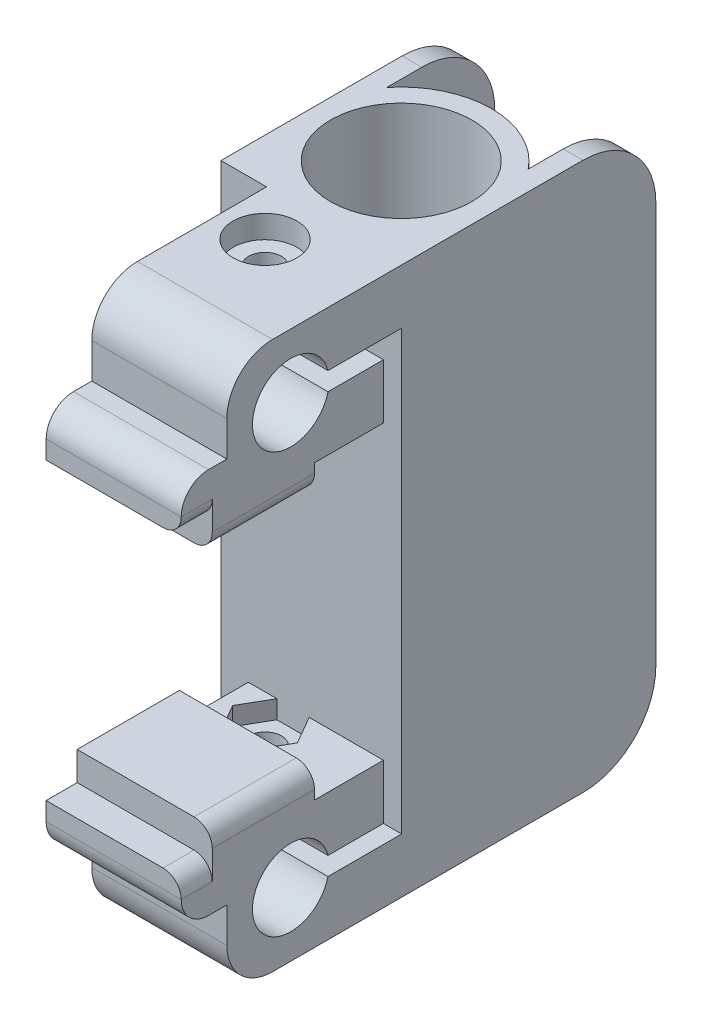
from build123d import *

# Parameters (mm, degrees)
SKETCH_1_W                = 15.5
SKETCH_1_H                = 11.302783866
EXTRUDE_1_DEPTH           = 60
SKETCH_2_R                = 4.2
CUT_EXTRUDE_1_DEPTH       = 90
CUT_EXTRUDE_2_DEPTH       = 40
SKETCH_4_W                = 15.5
SKETCH_4_H                = 19.5
SKETCH_4_H_2              = 7
CUT_EXTRUDE_3_DEPTH       = 6
FILLET_1_R                = 5
FILLET_2_R                = 8
SKETCH_13_R               = 1.8
CUT_EXTRUDE_9_DEPTH       = 75
CUT_EXTRUDE_10_DEPTH      = 34
CUT_EXTRUDE_10_DEPTH_BACK = 2
SKETCH_15_R               = 3.5
CUT_EXTRUDE_11_DEPTH      = 2.5
CUT_EXTRUDE_START         = -2.5
SKETCH_16_R               = 3.5
CUT_EXTRUDE_12_DEPTH      = 2.5
EXTRUDE_2_DEPTH           = 19.8
FILLET_3_R                = 3
SKETCH_18_R               = 2.25
CUT_EXTRUDE_13_DEPTH      = 9
FILLET_4_R                = 2
SKETCH_19_W               = 40.971402115
SKETCH_19_H               = 78.896815639
CUT_EXTRUDE_14_DEPTH      = 5


with BuildPart() as part:
    # Эскиз1 → Бобышка-Вытянуть1 (new body)
    with BuildSketch(Plane(origin=(0, 0, 0), x_dir=(1, 0, 0), z_dir=(0, 1, 0))):
        with BuildLine():
            Line((7.75, 0), (7.75, 6.160154219))
            ThreePointArc((7.75, 6.160154219), (0, 9.9), (-7.75, 6.160154219))
            Line((-7.75, 6.160154219), (-7.75, 1e-08))
            ThreePointArc((-7.75, 1e-08), (5e-09, 7.75), (7.75, 0))
        make_face()
        with BuildLine():
            ThreePointArc((0, -9.9), (4.302584876, -8.916151826), (7.75, -6.160154219))
            Line((7.75, -6.160154219), (7.75, 0))
            ThreePointArc((7.75, 0), (-5e-09, -7.75), (-7.75, 1e-08))
            Line((-7.75, 1e-08), (-7.75, -6.160154219))
            ThreePointArc((-7.75, -6.160154219), (-4.302584876, -8.916151826), (0, -9.9))
        make_face()
        with BuildLine():
            ThreePointArc((7.75, 6.160154219), (9.347058361, 3.262284476), (9.9, 0))
            Line((9.9, 0), (9.9, 18))
            Line((9.9, 18), (-9.9, 18))
            Line((-9.9, 18), (-9.9, 0))
            ThreePointArc((-9.9, 0), (-9.347058361, 3.262284476), (-7.75, 6.160154219))
            Line((-7.75, 6.160154219), (-7.75, 14))
            Line((-7.75, 14), (7.75, 14))
            Line((7.75, 14), (7.75, 6.160154219))
        make_face()
        with BuildLine():
            ThreePointArc((7.75, -6.160154219), (9.347058361, -3.262284476), (9.9, 0))
            ThreePointArc((9.9, 0), (9.347058361, 3.262284476), (7.75, 6.160154219))
            Line((7.75, 6.160154219), (7.75, 0))
            Line((7.75, 0), (7.75, -6.160154219))
        make_face()
        with BuildLine():
            Line((-7.75, 1e-08), (-7.75, 6.160154219))
            ThreePointArc((-7.75, 6.160154219), (-9.347058361, 3.262284476), (-9.9, 0))
            ThreePointArc((-9.9, 0), (-9.347058361, -3.262284476), (-7.75, -6.160154219))
            Line((-7.75, -6.160154219), (-7.75, 1e-08))
        make_face()
        with BuildLine():
            Line((9.9, -29), (9.9, 0))
            ThreePointArc((9.9, 0), (9.347058361, -3.262284476), (7.75, -6.160154219))
            Line((7.75, -6.160154219), (7.75, -9.9))
            Line((7.75, -9.9), (7.75, -11.85))
            Line((7.75, -11.85), (7.75, -23.152783866))
            Line((7.75, -23.152783866), (-7.75, -23.152783866))
            Line((-7.75, -23.152783866), (-7.75, -11.85))
            Line((-7.75, -11.85), (-7.75, -9.9))
            Line((-7.75, -9.9), (-7.75, -6.160154219))
            ThreePointArc((-7.75, -6.160154219), (-9.347058361, -3.262284476), (-9.9, 0))
            Line((-9.9, 0), (-9.9, -29))
            Line((-9.9, -29), (9.9, -29))
        make_face()
        with Locations((0, -17.501391933)):
            Rectangle(SKETCH_1_W, SKETCH_1_H)
        Polygon((7.75, -11.85), (7.75, -9.9), (0, -9.9), (-7.75, -9.9), (-7.75, -11.85), align=None)
        with BuildLine():
            Line((7.75, -9.9), (7.75, -6.160154219))
            ThreePointArc((7.75, -6.160154219), (4.302584876, -8.916151826), (0, -9.9))
            Line((0, -9.9), (7.75, -9.9))
        make_face()
        with BuildLine():
            Line((-7.75, -9.9), (0, -9.9))
            ThreePointArc((0, -9.9), (-4.302584876, -8.916151826), (-7.75, -6.160154219))
            Line((-7.75, -6.160154219), (-7.75, -9.9))
        make_face()
    extrude(amount=EXTRUDE_1_DEPTH)

    # Эскиз2 → Вырез-Вытянуть1 (cut)
    with BuildSketch(Plane(origin=(9.9, 0, 0), x_dir=(0, 0, -1), z_dir=(1, 0, 0))):
        with Locations((-22, 53)):
            Circle(SKETCH_2_R)
        with Locations((-22, 7)):
            Circle(SKETCH_2_R)
    extrude(amount=-CUT_EXTRUDE_1_DEPTH, mode=Mode.SUBTRACT)

    # Эскиз3 → Вырез-Вытянуть2 (cut)
    with BuildSketch(Plane(origin=(9.9, 0, 0), x_dir=(0, 0, -1), z_dir=(1, 0, 0))):
        Polygon((-29, 46), (-29, 14), (-11.85, 14), (-11.85, 8), (-22, 8), (-22, 6), (-9.85, 6), (-9.85, 54), (-22, 54), (-22, 52), (-11.85, 52), (-11.85, 46), align=None)
    extrude(amount=-CUT_EXTRUDE_2_DEPTH, mode=Mode.SUBTRACT)

    # Эскиз4 → Вырез-Вытянуть3 (cut)
    with BuildSketch(Plane(origin=(0, 0, -18), x_dir=(-1, 0, 0), z_dir=(0, 0, -1))):
        with Locations((0, 50.25)):
            Rectangle(SKETCH_4_W, SKETCH_4_H)
        with Locations((0, 30)):
            Rectangle(SKETCH_4_W, SKETCH_4_H_2)
        with Locations((0, 9.75)):
            Rectangle(SKETCH_4_W, SKETCH_4_H)
    extrude(amount=-CUT_EXTRUDE_3_DEPTH, mode=Mode.SUBTRACT)

    # Скругление1
    fillet_1_edges = [part.edges().sort_by_distance(p)[0] for p in [
        (0, 60, 29),
        (0, 0, 29),
    ]]
    fillet(fillet_1_edges, radius=FILLET_1_R)

    # Скругление2
    fillet_2_edges = [part.edges().sort_by_distance(p)[0] for p in [
        (-8.825, 60, -18),
        (-8.825, 0, -18),
        (8.825, 0, -18),
        (8.825, 60, -18),
    ]]
    fillet(fillet_2_edges, radius=FILLET_2_R)

    # Эскиз13 → Вырез-Вытянуть9 (cut)
    with BuildSketch(Plane.XZ):
        with Locations(Location((0, 14.920784389, 0), (0, 0, 270))):
            Circle(SKETCH_13_R)
    extrude(amount=-CUT_EXTRUDE_9_DEPTH, mode=Mode.SUBTRACT)

    # Эскиз14 → Вырез-Вытянуть10 (cut, two sides: drawn at the far end of the back side and taken through both)
    with BuildSketch(Plane(origin=(0, 14, 0), x_dir=(1, 0, 0), z_dir=(0, 1, 0)).offset(-CUT_EXTRUDE_10_DEPTH_BACK)):
        Polygon((-1.772918194, -17.991568778), (1.772918194, -17.991568778), (3.545836387, -14.920784389), (1.772918194, -11.85), (-1.772918194, -11.85), (-3.545836387, -14.920784389), align=None)
    extrude(amount=CUT_EXTRUDE_10_DEPTH + CUT_EXTRUDE_10_DEPTH_BACK, mode=Mode.SUBTRACT)

    # Эскиз15 → Вырез-Вытянуть11 (cut)
    with BuildSketch(Plane(origin=(0, 60, 0), x_dir=(1, 0, 0), z_dir=(0, 1, 0))):
        with Locations(Location((0, -14.920784389, 0), (0, 0, 270))):
            Circle(SKETCH_15_R)
    extrude(amount=-CUT_EXTRUDE_11_DEPTH, mode=Mode.SUBTRACT)

    # Эскиз16 → Вырез-Вытянуть12 (cut)
    with BuildSketch(Plane.XZ.offset(CUT_EXTRUDE_START)):
        with Locations(Location((0, 14.920784389, 0), (0, 0, 90))):
            Circle(SKETCH_16_R)
    extrude(amount=CUT_EXTRUDE_12_DEPTH, mode=Mode.SUBTRACT)

    # Эскиз17 → Бобышка-Вытянуть2 (add)
    with BuildSketch(Plane(origin=(9.9, 0, 0), x_dir=(0, 0, -1), z_dir=(1, 0, 0))):
        Polygon((-30.6, 43), (-19.4, 43), (-19.4, 46), (-29, 46), (-29, 51.15), (-34, 51.15), (-34, 46.15), (-30.6, 46.15), align=None)
        Polygon((-29, 14), (-19.4, 14), (-19.4, 17), (-28.462723747, 17), (-30.6, 17), (-30.6, 13.85), (-34, 13.85), (-34, 8.85), (-29.808389015, 8.85), (-29, 8.85), align=None)
    extrude(amount=-EXTRUDE_2_DEPTH)

    # Скругление3
    fillet_3_edges = [part.edges().sort_by_distance(p)[0] for p in [
        (0, 51.15, 34),
        (0, 8.85, 34),
    ]]
    fillet(fillet_3_edges, radius=FILLET_3_R)

    # Эскиз18 → Вырез-Вытянуть13 (cut)
    with BuildSketch(Plane.ZY.offset(9.9)):
        with Locations((25, 14)):
            Circle(SKETCH_18_R)
        with Locations((25, 46)):
            Circle(SKETCH_18_R)
    extrude(amount=-CUT_EXTRUDE_13_DEPTH, mode=Mode.SUBTRACT)

    # Скругление4
    fillet_4_edges = [part.edges().sort_by_distance(p)[0] for p in [
        (9.9, 13.85, 32.3),
        (9.9, 17, 25),
        (9.9, 43, 25),
        (9.9, 46.15, 32.3),
    ]]
    fillet(fillet_4_edges, radius=FILLET_4_R)

    # Эскиз19 → Вырез-Вытянуть14 (cut)
    with BuildSketch(Plane.ZY.offset(9.9)):
        with Locations((30.335701058, 24.667257597)):
            Rectangle(SKETCH_19_W, SKETCH_19_H)
    extrude(amount=-CUT_EXTRUDE_14_DEPTH, mode=Mode.SUBTRACT)


solid = part.part
